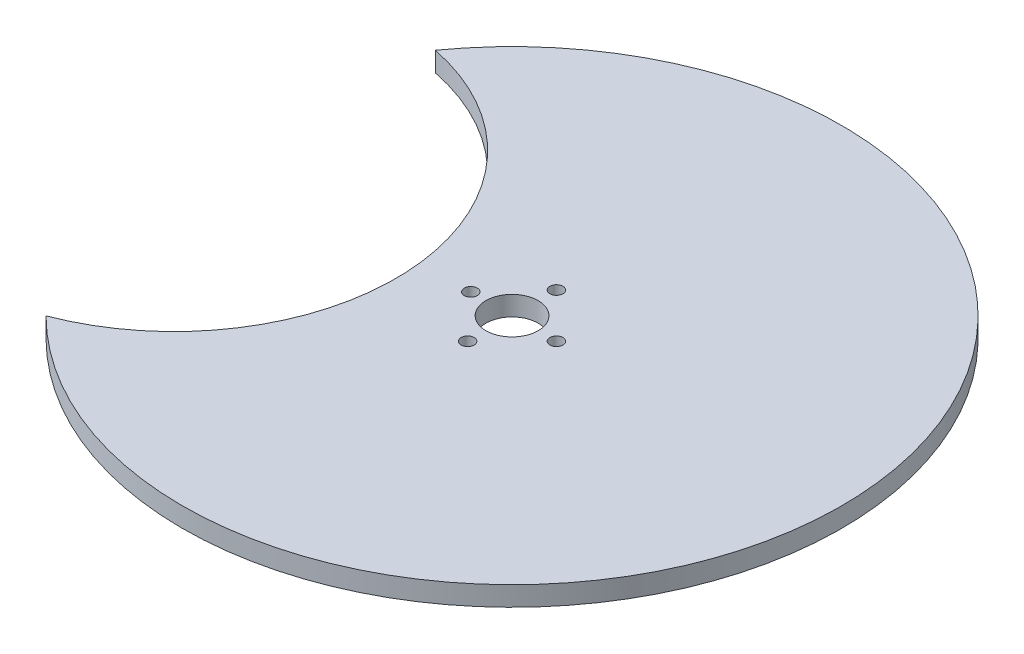
from build123d import *

# Parameters (mm, degrees)
SKETCH1_R           = 4
SKETCH1_R_2         = 1
BOSS_EXTRUDE1_DEPTH = 3


with BuildPart() as part:
    # Sketch1 → Boss-Extrude1 (new body)
    with BuildSketch(Plane(origin=(0, 0, 0), x_dir=(1, 0, 0), z_dir=(0, 1, 0))):
        with BuildLine():
            ThreePointArc((-35.678871137, -35.738888545), (50.325579201, 4.193575813), (-41.101893418, 29.340830893))
            ThreePointArc((-41.101893418, 29.340830893), (-13.951645719, -1.162575473), (-35.678871137, -35.738888545))
        make_face()
        with Locations(Location((0, 0, 0), (0, 0, 270))):
            Circle(SKETCH1_R, mode=Mode.SUBTRACT)
        with Locations(Location((-6.318484242, 0, 0), (0, 0, 270))):
            Circle(SKETCH1_R_2, mode=Mode.SUBTRACT)
        with Locations(Location((0, 6.8, 0), (0, 0, 270))):
            Circle(SKETCH1_R_2, mode=Mode.SUBTRACT)
        with Locations(Location((6.8, 0, 0), (0, 0, 270))):
            Circle(SKETCH1_R_2, mode=Mode.SUBTRACT)
        with Locations(Location((0, -6.8, 0), (0, 0, 270))):
            Circle(SKETCH1_R_2, mode=Mode.SUBTRACT)
    extrude(amount=BOSS_EXTRUDE1_DEPTH)


solid = part.part
